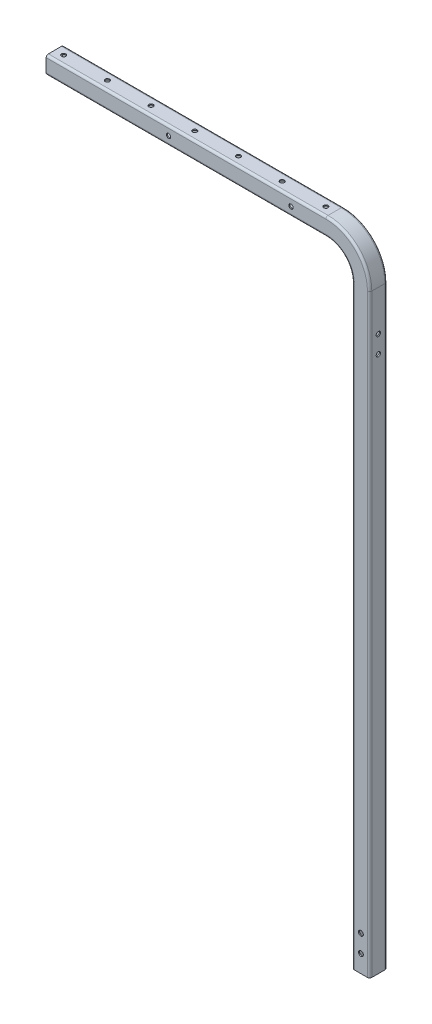
from build123d import *

# Parameters (mm, degrees)
SKETCH2_W                   = 25.4
SKETCH2_H                   = 25.4
FILLET1_R                   = 3.175
SHELL1_T                    = -1.5875
WOOD_HOLE_REACH             = 1041.462
SKETCH3_R                   = 3.175
LPATTERN1_COUNT             = 7
LPATTERN1_PITCH             = 63.5
SKETCH5_R                   = 3.175
CONT_MTG_DEPTH              = 1029.15108812
F_1_4_0_25_DIAMETER_HOLE1_D = 6.35
SKETCH8_R                   = 3.571875
CUT_EXTRUDE1_DEPTH          = 1029.386371944
LPATTERN2_COUNT             = 2
LPATTERN2_PITCH             = 25.4


with BuildPart() as part:
    # Base-Sweep: sweep along a path in Sketch1
    with BuildLine(Plane.XY) as base_sweep_path:
        Line((0, 0), (406.4, 0))
        ThreePointArc((406.4, 0), (442.321024484, -14.878975516), (457.2, -50.8))
        Line((457.2, -50.8), (457.2, -914.4))
    # Sketch2 (on Right Plane) → Base-Sweep (sweep)
    with BuildSketch(Plane(origin=(0, 0, 0), x_dir=(0, 0, -1), z_dir=(1, 0, 0))):
        Rectangle(SKETCH2_W, SKETCH2_H)
    sweep(path=base_sweep_path.line)

    # Fillet1
    fillet1_edges = [part.edges().sort_by_distance(p)[0] for p in [
        (451.301280605, -5.898719395, 12.7),
        (451.301280605, -5.898719395, -12.7),
        (433.340768363, -23.859231637, -12.7),
        (433.340768363, -23.859231637, 12.7),
        (469.9, -482.6, 12.7),
        (469.9, -482.6, -12.7),
        (444.5, -482.6, -12.7),
        (444.5, -482.6, 12.7),
        (203.2, 12.7, 12.7),
        (203.2, 12.7, -12.7),
        (203.2, -12.7, -12.7),
        (203.2, -12.7, 12.7),
    ]]
    fillet(fillet1_edges, radius=FILLET1_R)

    # Shell1
    shell1_openings = [part.faces().sort_by_distance(p)[0] for p in [
        (457.2, -914.4, 0),
        (0, 0, 0),
    ]]
    offset(amount=SHELL1_T, openings=shell1_openings, kind=Kind.INTERSECTION)

    # Sketch3 → Wood Hole (cut, up to next)
    with BuildSketch(Plane(origin=(0, 12.7, 0), x_dir=(-1, 0, 0), z_dir=(0, 1, 0)), mode=Mode.PRIVATE) as wood_hole_sk1:
        with Locations((-12.7, 0)):
            Circle(SKETCH3_R)
    wood_hole_tool1 = extrude(wood_hole_sk1.sketch, amount=-WOOD_HOLE_REACH, mode=Mode.PRIVATE) & part.part
    wood_hole = wood_hole_tool1.solids().sort_by_distance((12.7, 12.7, 0))[0]
    add(wood_hole, mode=Mode.SUBTRACT)

    # LPattern1: Wood Hole ×7
    with Locations(*[(i * LPATTERN1_PITCH, 0, 0) for i in range(1, LPATTERN1_COUNT)]):
        add(wood_hole, mode=Mode.SUBTRACT)

    # Sketch5 → cont_mtg (cut, through all)
    with BuildSketch(Plane(origin=(469.9, 0, 0), x_dir=(0, 0, -1), z_dir=(1, 0, 0))):
        with Locations(Location((0, -109.5375, 0), (0, 0, 90))):
            Circle(SKETCH5_R)
        with Locations(Location((0, -134.9375, 0), (0, 0, 90))):
            Circle(SKETCH5_R)
    extrude(amount=-CONT_MTG_DEPTH, mode=Mode.SUBTRACT)

    # 1/4 (0.25) Diameter Hole1 (through all)
    with Locations(Plane.XY.offset(12.7)):
        with Locations((177.8, 0), (355.6, 0)):
            Hole(F_1_4_0_25_DIAMETER_HOLE1_D / 2)

    # Sketch8 → Cut-Extrude1 (cut, through all)
    with BuildSketch(Plane(origin=(0, 0, -12.7), x_dir=(-1, 0, 0), z_dir=(0, 0, -1))):
        with Locations(Location((-457.2, -889, 0), (0, 0, 90))):
            Circle(SKETCH8_R)
    cut_extrude1 = extrude(amount=-CUT_EXTRUDE1_DEPTH, mode=Mode.SUBTRACT)

    # LPattern2: Cut-Extrude1 ×2
    with Locations(*[(0, i * LPATTERN2_PITCH, 0) for i in range(1, LPATTERN2_COUNT)]):
        add(cut_extrude1, mode=Mode.SUBTRACT)


solid = part.part
